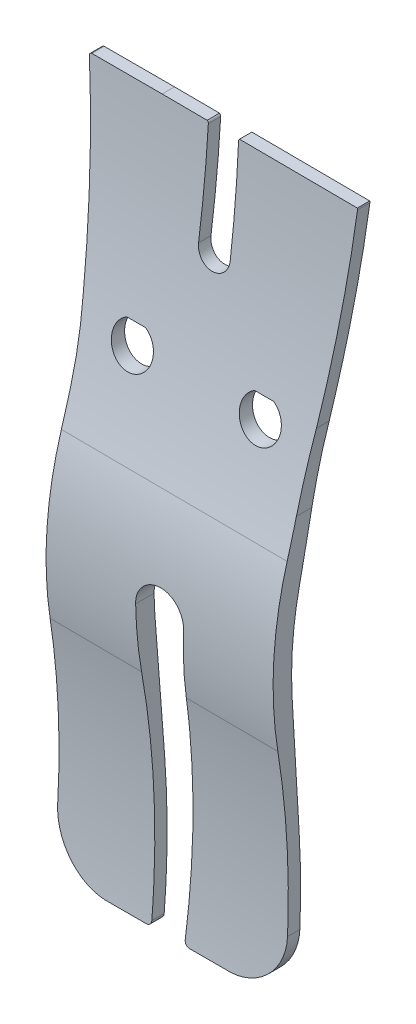
from build123d import *

# Parameters (mm, degrees)
BOSS_EXTRUDE1_DEPTH     = 92
CUT_EXTRUDE1_DEPTH      = 79
CUT_EXTRUDE1_DEPTH_BACK = 118
SKETCH3_OUTSIDE_W       = 130.624
SKETCH3_OUTSIDE_H       = 186.018
CUT_EXTRUDE2_DEPTH      = 81


with BuildPart() as part:
    # Sketch2 → Boss-Extrude1 (new body)
    with BuildSketch(Plane.XY):
        with BuildLine():
            Line((733.88097227, 512.409540482), (733.714590272, 485.398634247))
            ThreePointArc((733.714590272, 485.398634247), (736.969847934, 477.167503112), (744.977198909, 473.39516265))
            Line((744.977198909, 473.39516265), (754.180697278, 473.39516265))
            ThreePointArc((754.180697278, 473.39516265), (754.93321765, 473.712680398), (755.230833309, 474.473291567))
            Line((755.230833309, 474.473291567), (753.644223799, 534.77684994))
            ThreePointArc((753.644223799, 534.77684994), (755.079973826, 538.669205509), (758.892348589, 540.305545534))
            ThreePointArc((758.892348589, 540.305545534), (762.704723352, 538.669205509), (764.140473379, 534.77684994))
            Line((764.140473379, 534.77684994), (762.553863869, 474.473291567))
            ThreePointArc((762.553863869, 474.473291567), (762.851479527, 473.712680398), (763.6039999, 473.39516265))
            Line((763.6039999, 473.39516265), (772.807498269, 473.39516265))
            ThreePointArc((772.807498269, 473.39516265), (780.815918514, 477.166499838), (784.070106906, 485.398634247))
            Line((784.070106906, 485.398634247), (783.903724908, 512.409540482))
            Line((783.903724908, 512.409540482), (783.587761623, 563.703879936))
            ThreePointArc((783.587761623, 563.703879936), (783.77247461, 571.386020865), (784.420563352, 579.043003895))
            Line((784.420563352, 579.043003895), (788.264414586, 619.838080174))
            ThreePointArc((788.264414586, 619.838080174), (788.129918742, 620.240910995), (787.741481052, 620.412602475))
            Line((787.741481052, 620.412602475), (763.947048131, 620.430206642))
            Line((763.947048131, 620.430206642), (762.720599723, 620.430206642))
            ThreePointArc((762.720599723, 620.430206642), (762.341943379, 620.26897154), (762.195758152, 619.884254418))
            Line((762.195758152, 619.884254418), (762.351012345, 598.173946788))
            ThreePointArc((762.351012345, 598.173946788), (758.884364195, 594.707298638), (755.417716045, 598.173946788))
            Line((755.417716045, 598.173946788), (755.572970238, 619.86665025))
            ThreePointArc((755.572970238, 619.86665025), (755.426785011, 620.251367372), (755.048128667, 620.412602475))
            Line((755.048128667, 620.412602475), (753.837649047, 620.412602475))
            Line((753.837649047, 620.412602475), (730.043216126, 620.412602475))
            ThreePointArc((730.043216126, 620.412602475), (729.654778436, 620.240910995), (729.520282592, 619.838080174))
            Line((729.520282592, 619.838080174), (733.364133826, 579.043003895))
            ThreePointArc((733.364133826, 579.043003895), (733.483379901, 577.967121369), (733.593469282, 576.890263363))
            ThreePointArc((733.593469282, 576.890263363), (734.066308334, 570.3049022), (734.196935555, 563.703879936))
            Line((734.196935555, 563.703879936), (733.88097227, 512.409540482))
        make_face()
    extrude(amount=BOSS_EXTRUDE1_DEPTH)

    # Sketch3 outside → Cut-Extrude1 (cut, two sides: drawn at the far end of the back side and taken through both)
    with BuildSketch(Plane(origin=(730.696902853, -4.500952665, 0), x_dir=(0, 0, 1), z_dir=(-0.9999810289222565, 0.006159691192376741, 0)).offset(-CUT_EXTRUDE1_DEPTH_BACK)):
        with Locations((46, 551.577)):
            Rectangle(SKETCH3_OUTSIDE_W, SKETCH3_OUTSIDE_H)
        with BuildLine():
            Line((43.143604537, 477.975011324), (40.424473775, 477.975011324))
            ThreePointArc((40.424473775, 477.975011324), (39.281332513, 493.147025466), (39.432951406, 508.361288404))
            Line((39.432951406, 508.361288404), (40.812056524, 534.581043725))
            ThreePointArc((40.812056524, 534.581043725), (40.67113948, 544.675291647), (39.192711885, 554.661679912))
            ThreePointArc((39.192711885, 554.661679912), (35.60695145, 571.936620339), (32.326521857, 589.272133783))
            ThreePointArc((32.326521857, 589.272133783), (29.707708403, 607.06664821), (28.235119991, 624.992451149))
            Line((28.235119991, 624.992451149), (30.938516025, 624.992451149))
            ThreePointArc((30.938516025, 624.992451149), (34.470259418, 592.692390498), (41.750655625, 561.025957788))
            ThreePointArc((41.750655625, 561.025957788), (44.799963896, 543.735773309), (44.004202882, 526.196801712))
            ThreePointArc((44.004202882, 526.196801712), (41.914294104, 502.115525022), (43.143604537, 477.975011324))
        make_face(mode=Mode.SUBTRACT)
    extrude(amount=CUT_EXTRUDE1_DEPTH + CUT_EXTRUDE1_DEPTH_BACK, mode=Mode.SUBTRACT)

    # Sketch4 → Cut-Extrude2 (cut)
    with BuildSketch(Plane.XY):
        with BuildLine():
            Line((770.830795776, 579.39516265), (774.953901402, 579.39516265))
            ThreePointArc((774.953901402, 579.39516265), (772.892348589, 570.89516265), (770.830795776, 579.39516265))
        make_face()
        with BuildLine():
            Line((742.830795776, 579.39516265), (746.953901402, 579.39516265))
            ThreePointArc((746.953901402, 579.39516265), (744.892348589, 570.89516265), (742.830795776, 579.39516265))
        make_face()
    extrude(amount=CUT_EXTRUDE2_DEPTH, mode=Mode.SUBTRACT)


solid = part.part
